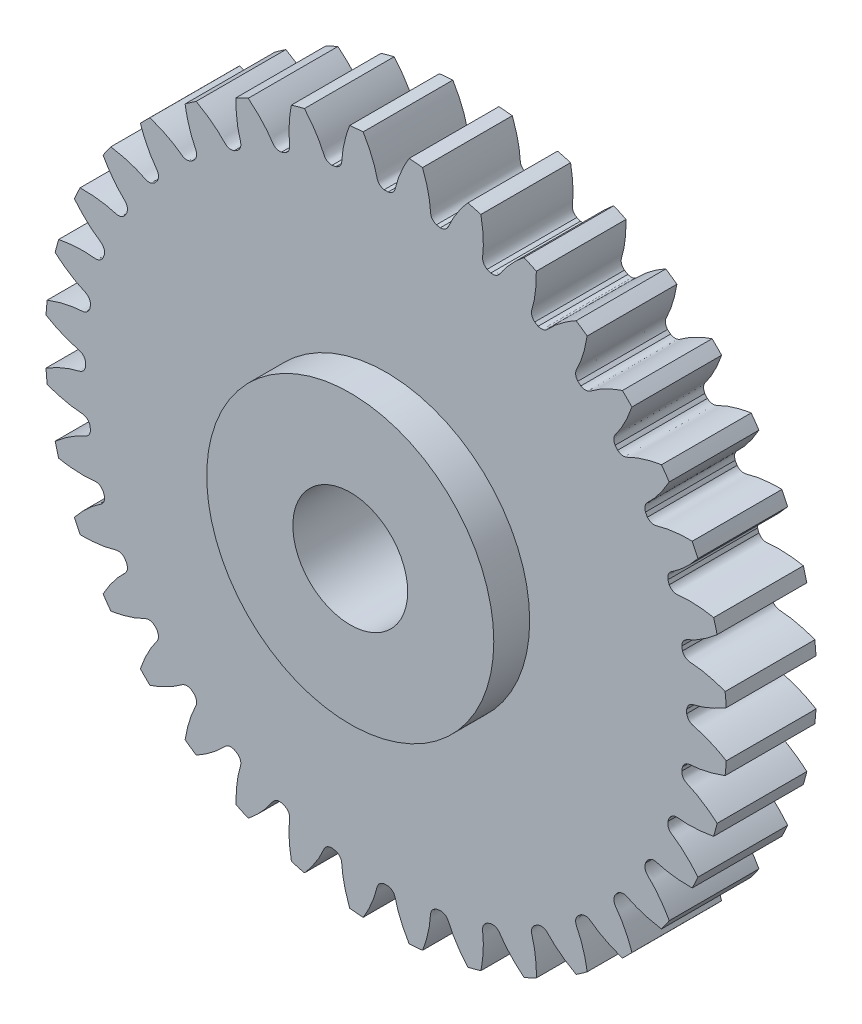
from build123d import *

# Parameters (mm, degrees)
SKETCH_1_R               = 9.5
EXTRUDE_1_DEPTH          = 2.5
CUT_EXTRUDE_1_DEPTH      = 14.665650369
PATTERN_CIRCULAR_1_COUNT = 36
SKETCH_4_R               = 4
EXTRUDE_2_DEPTH          = 3.5
CUT_EXTRUDE_2_REACH      = 15.854
SKETCH_5_R               = 1.6


with BuildPart() as part:
    # 草图1 → 凸台-拉伸1 (new body)
    with BuildSketch(Plane.XY):
        Circle(SKETCH_1_R)
    extrude(amount=EXTRUDE_1_DEPTH)

    # 草图2 → 切除-拉伸1 (cut, through all)
    with BuildSketch(Plane.XY):
        with BuildLine():
            ThreePointArc((0.054934474, 8.374819831), (0, 8.375), (-0.054934474, 8.374819831))
            add(Edge.make_bspline(
                [(-0.054934474, 8.374819831), (-0.234978953, 8.415201319), (-0.250497423, 8.549314662), (-0.288218357, 8.691373568), (-0.299748628, 8.731851177), (-0.31309989, 8.775314366), (-0.328367396, 8.821718829), (-0.34568221, 8.870999935), (-0.365162519, 8.923094297), (-0.386928046, 8.977933385), (-0.411095645, 9.035445483), (-0.437780475, 9.09555517), (-0.467095531, 9.15818354), (-0.499151661, 9.223248205), (-0.534057436, 9.290663368), (-0.571919068, 9.360339873), (-0.612840323, 9.432185269), (-0.656922424, 9.506103874), (-0.704263969, 9.581996838), (-0.754960844, 9.659762209), (-0.809106137, 9.739295006), (-0.866790057, 9.820487287), (-0.928099853, 9.903228226), (-0.993119734, 9.987404187), (-1.061930793, 10.072898798), (-1.134610932, 10.15959304), (-1.211234787, 10.247365317), (-1.291873657, 10.33609155), (-1.376595441, 10.425645255), (-1.46546454, 10.515897632), (-1.591181957, 10.63856609), (-1.689482035, 10.72881939), (-1.757006718, 10.78843362)],
                knots=[0, 0, 0, 0, 0.120371484, 0.133302531, 0.147363917, 0.16255564, 0.178877702, 0.196330101, 0.214912839, 0.234625915, 0.25546933, 0.277443082, 0.300547173, 0.324781601, 0.350146368, 0.376641473, 0.404266917, 0.433022698, 0.462908818, 0.493925275, 0.526072071, 0.559349205, 0.593756678, 0.629294488, 0.665962637, 0.703761124, 0.742689949, 0.782749112, 0.823938613, 0.866258453, 0.90970863, 1, 1, 1, 1], degree=3))
            ThreePointArc((-1.757006718, 10.78843362), (0, 10.930570551), (1.757006718, 10.78843362))
            add(Edge.make_bspline(
                [(0.054934474, 8.374819831), (0.234978953, 8.415201319), (0.250497423, 8.549314662), (0.288218357, 8.691373568), (0.299748628, 8.731851177), (0.31309989, 8.775314366), (0.328367396, 8.821718829), (0.34568221, 8.870999935), (0.365162519, 8.923094297), (0.386928046, 8.977933385), (0.411095645, 9.035445483), (0.437780475, 9.09555517), (0.467095531, 9.15818354), (0.499151661, 9.223248205), (0.534057436, 9.290663368), (0.571919068, 9.360339873), (0.612840323, 9.432185269), (0.656922424, 9.506103874), (0.704263969, 9.581996838), (0.754960844, 9.659762209), (0.809106137, 9.739295006), (0.866790057, 9.820487287), (0.928099853, 9.903228226), (0.993119734, 9.987404187), (1.061930793, 10.072898798), (1.134610932, 10.15959304), (1.211234787, 10.247365317), (1.291873657, 10.33609155), (1.376595441, 10.425645255), (1.46546454, 10.515897632), (1.591181957, 10.63856609), (1.689482035, 10.72881939), (1.757006718, 10.78843362)],
                knots=[0, 0, 0, 0, 0.120371484, 0.133302531, 0.147363917, 0.16255564, 0.178877702, 0.196330101, 0.214912839, 0.234625915, 0.25546933, 0.277443082, 0.300547173, 0.324781601, 0.350146368, 0.376641473, 0.404266917, 0.433022698, 0.462908818, 0.493925275, 0.526072071, 0.559349205, 0.593756678, 0.629294488, 0.665962637, 0.703761124, 0.742689949, 0.782749112, 0.823938613, 0.866258453, 0.90970863, 1, 1, 1, 1], degree=3))
        make_face()
    cut_extrude_1 = extrude(amount=CUT_EXTRUDE_1_DEPTH, mode=Mode.SUBTRACT)

    # 阵列(圆周)1: 切除-拉伸1 ×36 about axis
    pattern_circular_1_axis = Axis((0, 0, 2.5), (0, 0, -1))
    for i in range(1, PATTERN_CIRCULAR_1_COUNT):
        add(cut_extrude_1.rotate(pattern_circular_1_axis, i * 360 / PATTERN_CIRCULAR_1_COUNT), mode=Mode.SUBTRACT)

    # 草图4 → 凸台-拉伸2 (add)
    with BuildSketch(Plane(origin=(0, 0, 0), x_dir=(-1, 0, 0), z_dir=(0, 0, -1))):
        with Locations(Location((0, 0, 0), (0, 0, 180))):
            Circle(SKETCH_4_R)
    extrude(amount=-EXTRUDE_2_DEPTH)

    # 草图5 → 切除-拉伸2 (cut, up to next)
    with BuildSketch(Plane.XY.offset(3.5), mode=Mode.PRIVATE) as cut_extrude_2_sk1:
        Circle(SKETCH_5_R)
    cut_extrude_2_tool1 = extrude(cut_extrude_2_sk1.sketch, amount=-CUT_EXTRUDE_2_REACH, mode=Mode.PRIVATE) & part.part
    add(cut_extrude_2_tool1.solids().sort_by_distance((0, 0, 3.5))[0], mode=Mode.SUBTRACT)


solid = part.part
